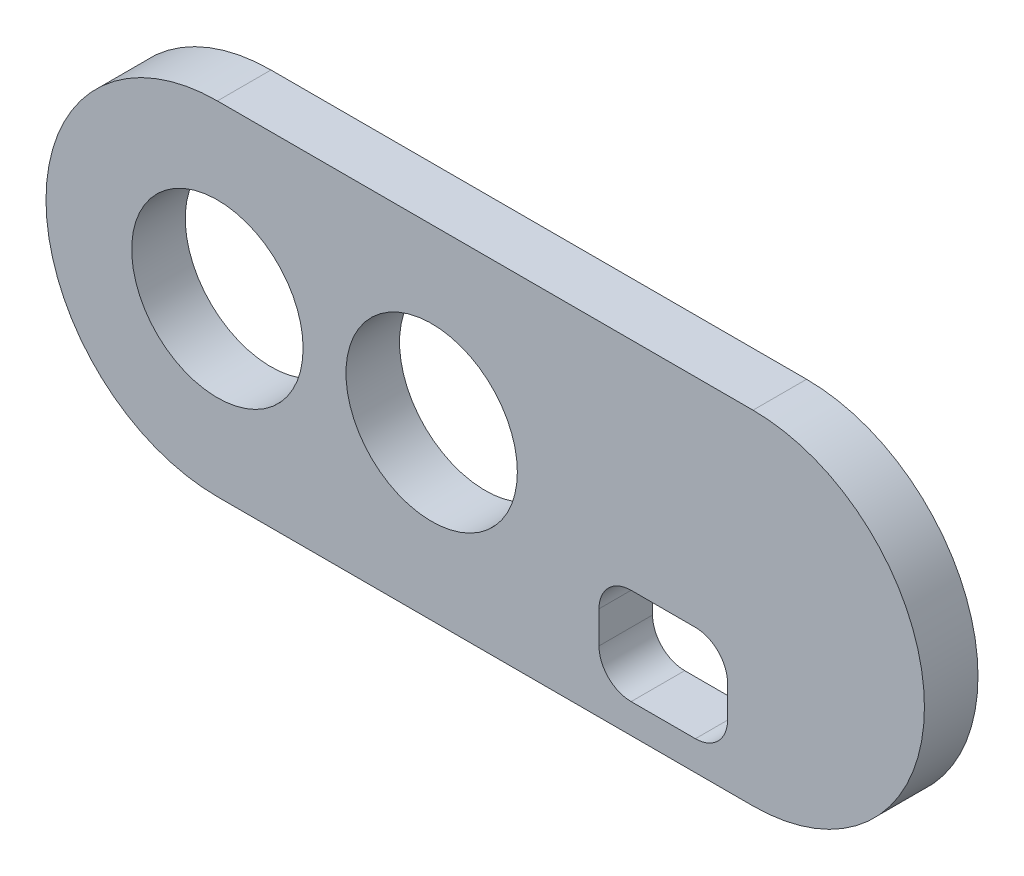
from build123d import *

# Parameters (mm, degrees)
SKETCH_1_R      = 8
EXTRUDE_1_DEPTH = 5


with BuildPart() as part:
    # 草图1 → 凸台-拉伸1 (new body)
    with BuildSketch(Plane.XY):
        with BuildLine():
            ThreePointArc((-21.649032952, 39.411076993), (-37.649032952, 23.411076993), (-21.649032952, 7.411076993))
            Line((-21.649032952, 7.411076993), (28.350967048, 7.411076993))
            ThreePointArc((28.350967048, 7.411076993), (44.350967048, 23.411076993), (28.350967048, 39.411076993))
            Line((28.350967048, 39.411076993), (-21.649032952, 39.411076993))
        make_face()
        with Locations((-21.649032952, 23.411076993)):
            Circle(SKETCH_1_R, mode=Mode.SUBTRACT)
        with Locations((-1.649032952, 23.411076993)):
            Circle(SKETCH_1_R, mode=Mode.SUBTRACT)
        with BuildLine():
            ThreePointArc((16.970957649, 10.16166095), (14.849637306, 11.040340606), (13.970957649, 13.16166095))
            Line((13.970957649, 13.16166095), (13.970957649, 16.16166095))
            ThreePointArc((13.970957649, 16.16166095), (14.849637306, 18.282981293), (16.970957649, 19.16166095))
            Line((16.970957649, 19.16166095), (22.970957649, 19.16166095))
            ThreePointArc((22.970957649, 19.16166095), (25.092277993, 18.282981293), (25.970957649, 16.16166095))
            Line((25.970957649, 16.16166095), (25.970957649, 13.16166095))
            ThreePointArc((25.970957649, 13.16166095), (25.092277993, 11.040340606), (22.970957649, 10.16166095))
            Line((22.970957649, 10.16166095), (16.970957649, 10.16166095))
        make_face(mode=Mode.SUBTRACT)
    extrude(amount=EXTRUDE_1_DEPTH)


solid = part.part
